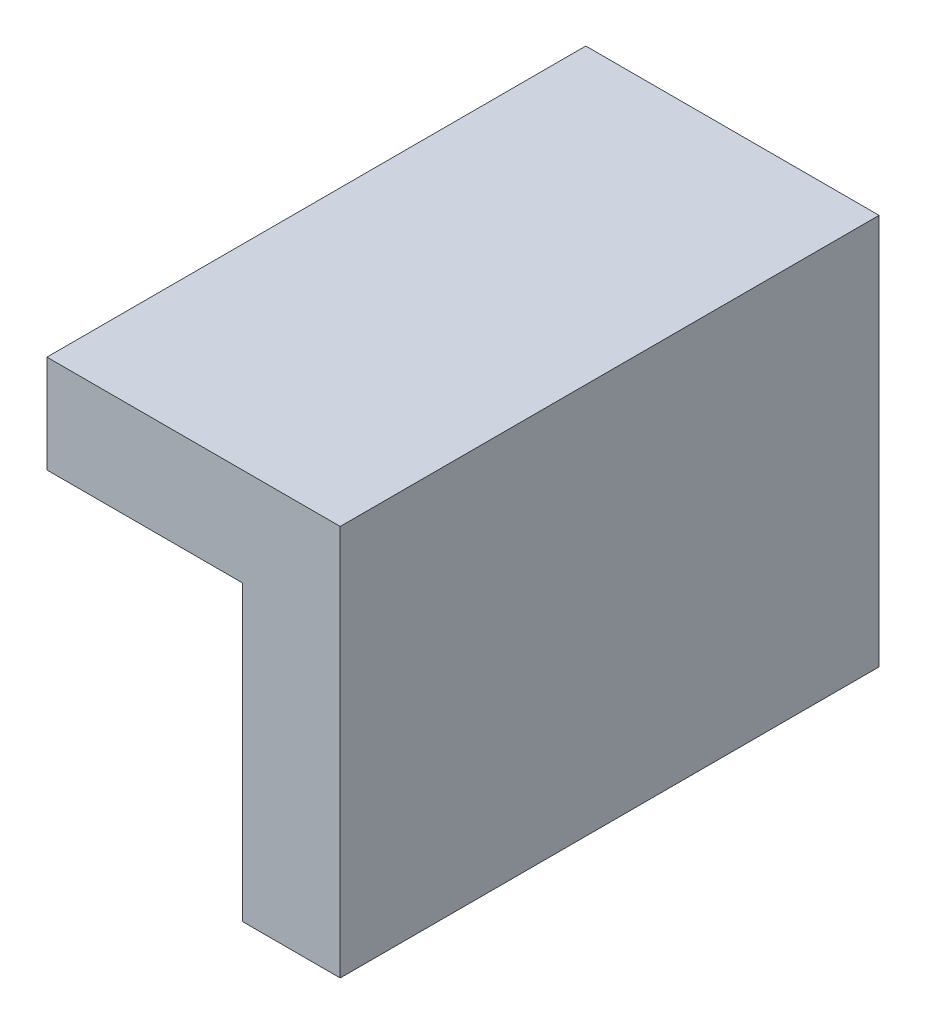
from build123d import *

# Parameters (mm, degrees)
CROQUIS1_W              = 110
CROQUIS1_H              = 50.8
SALIENTE_EXTRUIR1_DEPTH = 12.7
CROQUIS2_W              = 50.8
CROQUIS2_H              = 220
SALIENTE_EXTRUIR2_DEPTH = 12.7
CROQUIS4_W              = 25.4
CROQUIS4_H              = 12.7
SALIENTE_EXTRUIR3_DEPTH = 57.3
CROQUIS5_W              = 50.8
CROQUIS5_H              = 50.8
CROQUIS5_W_2            = 59.2
CORTAR_EXTRUIR1_DEPTH   = 211.184323868


with BuildPart() as part:
    # Croquis1 → Saliente-Extruir1 (new body)
    with BuildSketch(Plane.XY):
        Rectangle(CROQUIS1_W, CROQUIS1_H)
    extrude(amount=SALIENTE_EXTRUIR1_DEPTH)

    # Croquis2 → Saliente-Extruir2 (add)
    with BuildSketch(Plane(origin=(0, 0, 0), x_dir=(-1, 0, 0), z_dir=(0, 0, -1))):
        with Locations((-29.6, 84.6)):
            Rectangle(CROQUIS2_W, CROQUIS2_H)
    extrude(amount=SALIENTE_EXTRUIR2_DEPTH)

    # Croquis4 → Saliente-Extruir3 (add)
    with BuildSketch(Plane(origin=(0, 0, -12.7), x_dir=(-1, 0, 0), z_dir=(0, 0, -1))):
        Polygon((-42.3, 194.6), (-55, 194.6), (-55, 143.8), (-42.3, 143.8), (-42.3, 181.9), align=None)
        with Locations((-29.6, 188.25)):
            Rectangle(CROQUIS4_W, CROQUIS4_H)
    extrude(amount=SALIENTE_EXTRUIR3_DEPTH)

    # Croquis5 → Cortar-Extruir1 (cut, through all)
    with BuildSketch(Plane(origin=(0, 0, -12.7), x_dir=(-1, 0, 0), z_dir=(0, 0, -1))):
        Polygon((-55, 143.8), (-55, 25.4), (-4.2, 25.4), (-4.2, 194.6), (-16.9, 194.6), (-16.9, 181.9), (-42.3, 181.9), (-42.3, 143.8), align=None)
        with Locations((-29.6, 0)):
            Rectangle(CROQUIS5_W, CROQUIS5_H)
        with Locations((25.4, 0)):
            Rectangle(CROQUIS5_W_2, CROQUIS5_H)
    extrude(amount=-CORTAR_EXTRUIR1_DEPTH, mode=Mode.SUBTRACT)


solid = part.part
